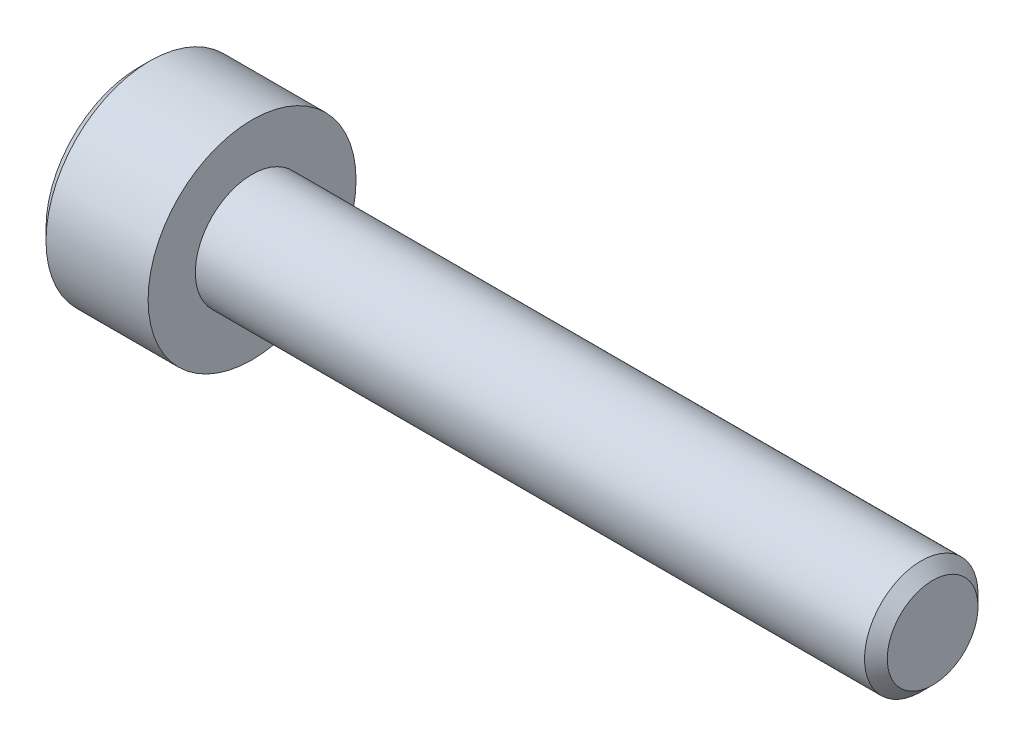
from build123d import *

# Parameters (mm, degrees)
SKETCH1_W           = 3
SKETCH1_H           = 2.75
SKETCH2_R           = 1.5
BOSS_EXTRUDE1_DEPTH = 18
CUT_EXTRUDE1_DEPTH  = 1.5
CHAMFER1_SIZE       = 0.3


with BuildPart() as part:
    # Sketch1 → Revolve1 (revolve)
    with BuildSketch(Plane.XY, mode=Mode.PRIVATE) as revolve1_sk:
        with Locations((-1.5, 1.375)):
            Rectangle(SKETCH1_W, SKETCH1_H)
    revolve(revolve1_sk.sketch.rotate(Axis((-3, 0, 0), (1, 0, 0)), 270), axis=Axis((-3, 0, 0), (1, 0, 0)))

    # Sketch2 → Boss-Extrude1 (add)
    with BuildSketch(Plane(origin=(0, 0, 0), x_dir=(0, 0, -1), z_dir=(1, 0, 0))):
        Circle(SKETCH2_R)
    extrude(amount=BOSS_EXTRUDE1_DEPTH)

    # Sketch3 → Cut-Extrude1 (cut)
    with BuildSketch(Plane.ZY.offset(3)):
        Polygon((1.25, -0.721687836), (1.25, 0.721687836), (0, 1.443375673), (-1.25, 0.721687836), (-1.25, -0.721687836), (0, -1.443375673), align=None)
    extrude(amount=-CUT_EXTRUDE1_DEPTH, mode=Mode.SUBTRACT)

    # Sketch4 → Cut-Revolve1 (revolve, cut)
    with BuildSketch(Plane.XY, mode=Mode.PRIVATE) as cut_revolve1_sk:
        Polygon((-1.5, 1.25), (-1.5, 0), (-1.165063509, 0), align=None)
    revolve(cut_revolve1_sk.sketch.rotate(Axis((-1.500025, 0, 0), (1, 0, 0)), 90), axis=Axis((-1.500025, 0, 0), (1, 0, 0)), mode=Mode.SUBTRACT)

    # Chamfer1
    chamfer1_edges = [part.edges().sort_by_distance(p)[0] for p in [
        (-3, 0, 2.75),
        (18, 0, 1.5),
    ]]
    chamfer(chamfer1_edges, length=CHAMFER1_SIZE)


solid = part.part
